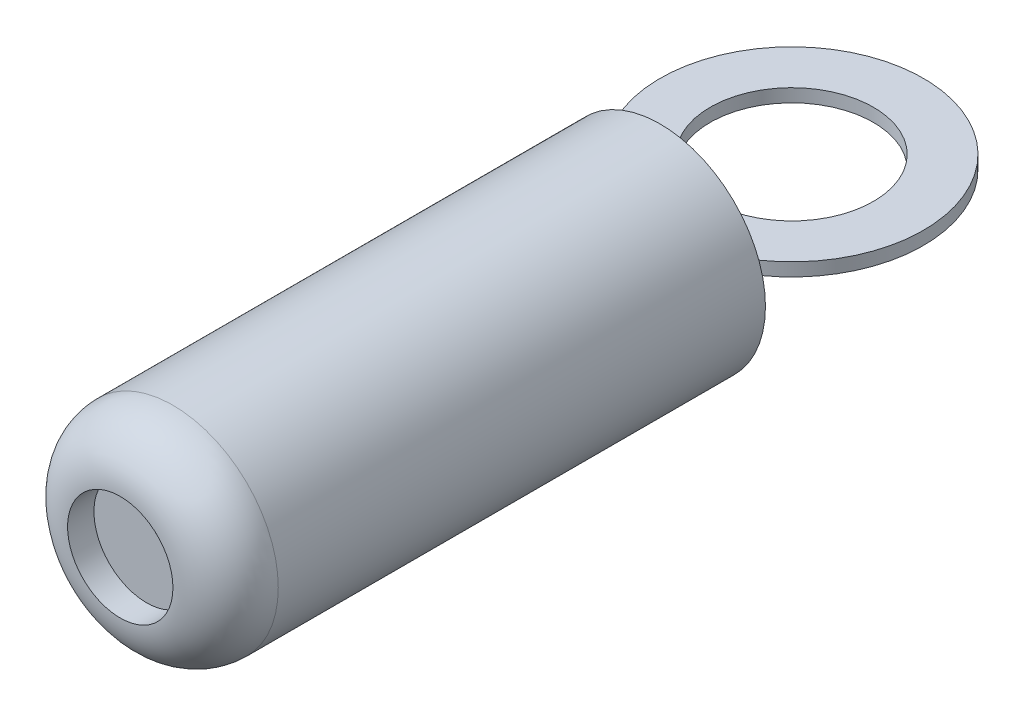
from build123d import *

# Parameters (mm, degrees)
SKETCH_8_R          = 4
EXTRUDE_4_DEPTH     = 20.5
SKETCH_10_R         = 5
SKETCH_10_R_2       = 3.1
EXTRUDE_5_DEPTH     = 0.5
FILLET_1_R          = 2
SKETCH_11_R         = 2
CUT_EXTRUDE_1_DEPTH = 1


with BuildPart() as part:
    # ｽｹｯﾁ8 → ﾎﾞｽ - 押し出し4 (new body)
    with BuildSketch(Plane.XY):
        Circle(SKETCH_8_R)
    extrude(amount=EXTRUDE_4_DEPTH)

    # ﾌｨﾚｯﾄ1
    fillet_1_edges = [part.edges().sort_by_distance(p)[0] for p in [
        (-4, 0, 20.5),
    ]]
    fillet(fillet_1_edges, radius=FILLET_1_R)

    # ｽｹｯﾁ11 → ｶｯﾄ - 押し出し1 (cut)
    with BuildSketch(Plane.XY.offset(20.5)):
        Circle(SKETCH_11_R)
    extrude(amount=-CUT_EXTRUDE_1_DEPTH, mode=Mode.SUBTRACT)


with BuildPart() as body_2:
    # ｽｹｯﾁ10 → ﾎﾞｽ - 押し出し5 (new body)
    with BuildSketch(Plane(origin=(0, 0, 0), x_dir=(1, 0, 0), z_dir=(0, 1, 0))):
        with Locations(Location((0, 5, 0), (0, 0, 270))):
            Circle(SKETCH_10_R)
        with Locations(Location((0, 5, 0), (0, 0, 270))):
            Circle(SKETCH_10_R_2, mode=Mode.SUBTRACT)
    extrude(amount=EXTRUDE_5_DEPTH)


solid = Compound([part.part, body_2.part])
